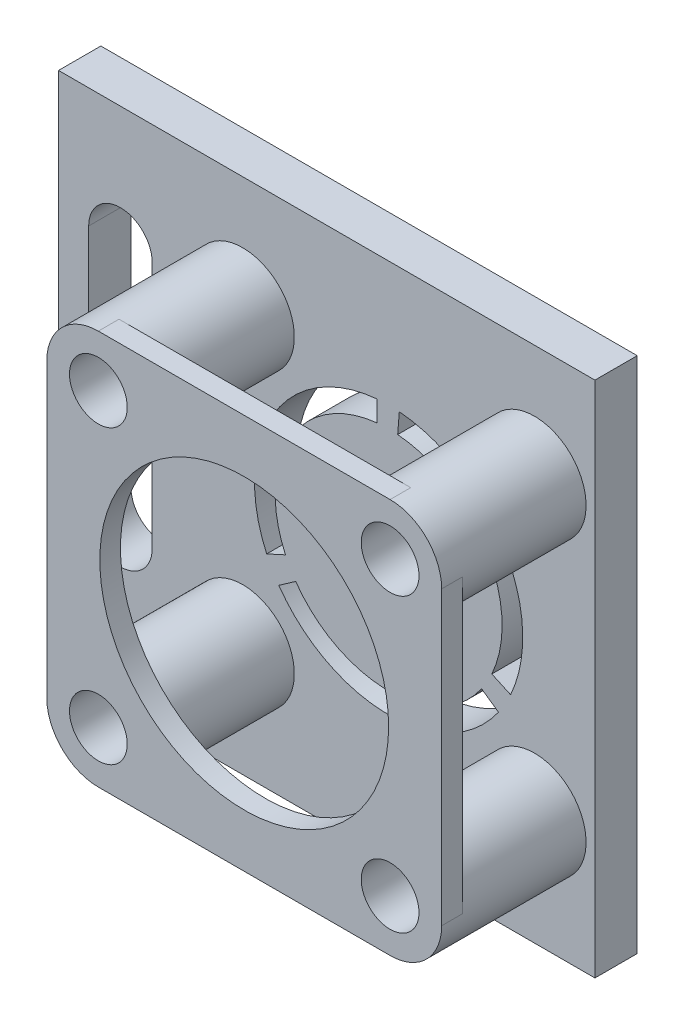
from build123d import *

# Parameters (mm, degrees)
SKETCH1_W           = 26
SKETCH1_H           = 25.1
BOSS_EXTRUDE1_DEPTH = 2.05
CUT_EXTRUDE1_DEPTH  = 19.185296258
SKETCH3_R           = 2.5
BOSS_EXTRUDE2_DEPTH = 6
SKETCH4_R           = 7
BOSS_EXTRUDE3_DEPTH = 1
SKETCH5_R           = 1.4
CUT_EXTRUDE2_DEPTH  = 9.05


with BuildPart() as part:
    # Sketch1 → Boss-Extrude1 (new body)
    with BuildSketch(Plane.XY):
        Rectangle(SKETCH1_W, SKETCH1_H)
    extrude(amount=BOSS_EXTRUDE1_DEPTH)

    # Sketch2 → Cut-Extrude1 (cut, through all)
    with BuildSketch(Plane.XY.offset(2.05)):
        with BuildLine():
            Line((-8.46, -5.25), (-8.46, 6.75))
            ThreePointArc((-8.46, 6.75), (-10, 8.29), (-11.54, 6.75))
            Line((-11.54, 6.75), (-11.54, -5.25))
            ThreePointArc((-11.54, -5.25), (-10, -6.79), (-8.46, -5.25))
        make_face()
        with BuildLine():
            ThreePointArc((-2.002069244, -2.286766992), (-1.773484699, 2.732003629), (2.438049628, 5.471216664))
            Line((2.438049628, 5.471216664), (2.438049628, 6.475663038))
            ThreePointArc((2.438049628, 6.475663038), (-2.615725538, 3.273167683), (-2.91153638, -2.702542808))
            Line((-2.91153638, -2.702542808), (-2.002069244, -2.286766992))
        make_face()
        with BuildLine():
            Line((3.517695015, 6.479351192), (3.438049628, 5.482527932))
            ThreePointArc((3.438049628, 5.482527932), (7.742278908, 2.785819585), (8.002069244, -2.286766992))
            Line((8.002069244, -2.286766992), (8.91153638, -2.702542808))
            ThreePointArc((8.91153638, -2.702542808), (8.604511436, 3.292332237), (3.517695015, 6.479351192))
        make_face()
        with BuildLine():
            ThreePointArc((7.505336244, -3.1546704), (3, -5.5), (-1.505336244, -3.1546704))
            Line((-1.505336244, -3.1546704), (-2.324488288, -3.728246836))
            ThreePointArc((-2.324488288, -3.728246836), (3, -6.5), (8.324488288, -3.728246836))
            Line((8.324488288, -3.728246836), (7.505336244, -3.1546704))
        make_face()
    extrude(amount=-CUT_EXTRUDE1_DEPTH, mode=Mode.SUBTRACT)

    # Sketch3 → Boss-Extrude2 (add)
    with BuildSketch(Plane.XY.offset(2.05)):
        with Locations(Location((-4.071067812, 7.071067812, 0), (0, 0, 180))):
            Circle(SKETCH3_R)
        with Locations(Location((10.071067812, 7.071067812, 0), (0, 0, 180))):
            Circle(SKETCH3_R)
        with Locations(Location((10.071067812, -7.071067812, 0), (0, 0, 180))):
            Circle(SKETCH3_R)
        with Locations(Location((-4.071067812, -7.071067812, 0), (0, 0, 180))):
            Circle(SKETCH3_R)
    extrude(amount=BOSS_EXTRUDE2_DEPTH)

    # Sketch4 → Boss-Extrude3 (add)
    with BuildSketch(Plane.XY.offset(8.05)):
        with BuildLine():
            Line((-4.071067812, 9.571067812), (10.071067812, 9.571067812))
            ThreePointArc((10.071067812, 9.571067812), (11.838834765, 8.838834765), (12.571067812, 7.071067812))
            Line((12.571067812, 7.071067812), (12.571067812, -7.071067812))
            ThreePointArc((12.571067812, -7.071067812), (11.838834765, -8.838834765), (10.071067812, -9.571067812))
            Line((10.071067812, -9.571067812), (-4.071067812, -9.571067812))
            ThreePointArc((-4.071067812, -9.571067812), (-5.838834765, -8.838834765), (-6.571067812, -7.071067812))
            Line((-6.571067812, -7.071067812), (-6.571067812, 7.071067812))
            ThreePointArc((-6.571067812, 7.071067812), (-5.838834765, 8.838834765), (-4.071067812, 9.571067812))
        make_face()
        with Locations((3, 0)):
            Circle(SKETCH4_R, mode=Mode.SUBTRACT)
    extrude(amount=BOSS_EXTRUDE3_DEPTH)

    # Sketch5 → Cut-Extrude2 (cut)
    with BuildSketch(Plane.XY.offset(9.05)):
        with Locations((-4.071067812, -7.071067812)):
            Circle(SKETCH5_R)
        with Locations((-4.071067812, 7.071067812)):
            Circle(SKETCH5_R)
        with Locations((10.071067812, 7.071067812)):
            Circle(SKETCH5_R)
        with Locations((10.071067812, -7.071067812)):
            Circle(SKETCH5_R)
    extrude(amount=-CUT_EXTRUDE2_DEPTH, mode=Mode.SUBTRACT)


solid = part.part
